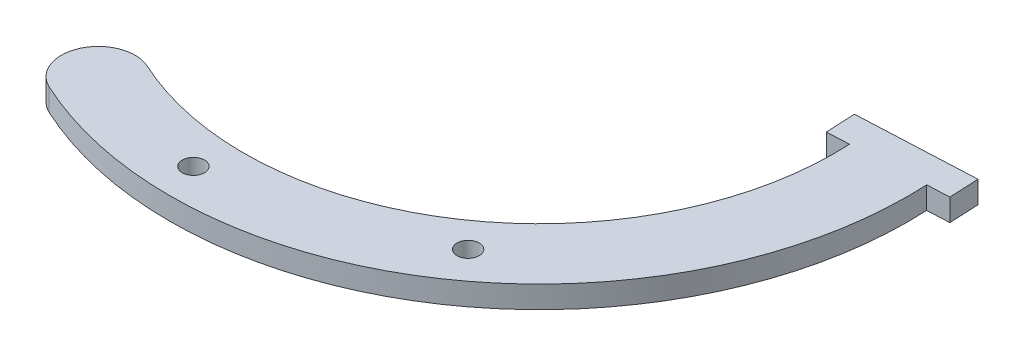
from build123d import *

# Parameters (mm, degrees)
SKETCH_1_R      = 1.5
EXTRUDE_1_DEPTH = 3


with BuildPart() as part:
    # 草图1 → 凸台-拉伸1 (new body)
    with BuildSketch(Plane(origin=(0, 0, 0), x_dir=(1, 0, 0), z_dir=(0, 1, 0))):
        with BuildLine():
            Line((61.021952874, 33.604841535), (61.023746461, 33.569203074))
            ThreePointArc((61.023746461, 33.569203074), (43.480612021, -1.558361335), (4.346639213, -4.758286247))
            ThreePointArc((4.346639213, -4.758286247), (-2.286053035, -7.209284728), (0.164945446, -13.841976975))
            ThreePointArc((0.164945446, -13.841976975), (49.082411457, -9.842070835), (71.011329506, 34.067384676))
            Line((71.011329506, 34.067384676), (74.008078898, 34.206144673))
            Line((74.008078898, 34.206144673), (73.823063114, 38.201863527))
            Line((73.823063114, 38.201863527), (57.840187699, 37.461800392))
            Line((57.840187699, 37.461800392), (58.025203482, 33.466081538))
            Line((58.025203482, 33.466081538), (61.021952874, 33.604841535))
        make_face()
        with Locations((19.224207172, -13.390815296)):
            Circle(SKETCH_1_R, mode=Mode.SUBTRACT)
        with Locations((47.537682651, -4.519860589)):
            Circle(SKETCH_1_R, mode=Mode.SUBTRACT)
    extrude(amount=EXTRUDE_1_DEPTH)


solid = part.part
